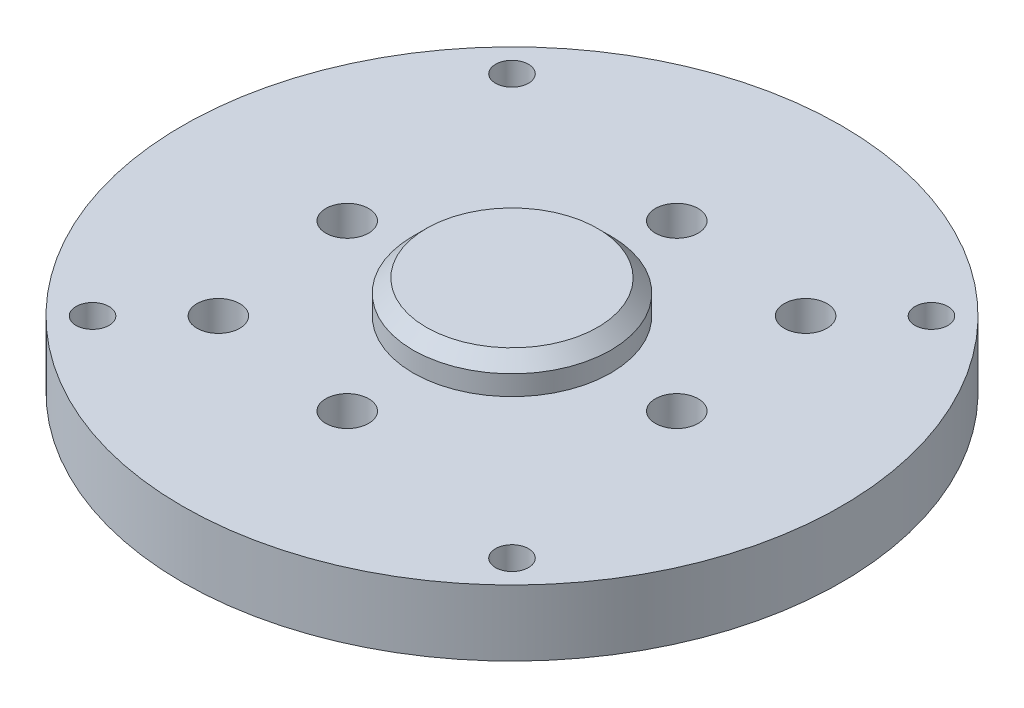
from build123d import *

# Parameters (mm, degrees)
SKETCH1_W               = 100
SKETCH1_H               = 100
BOSS_EXTRUDE1_DEPTH     = 10
SKETCH2_R               = 3.25
CUT_EXTRUDE1_DEPTH      = 10
SKETCH3_OUTSIDE_W       = 130.354
SKETCH3_OUTSIDE_H       = 130.354
SKETCH3_OUTSIDE_R       = 50
CUT_EXTRUDE2_DEPTH      = 10
SKETCH4_R               = 2.5
CUT_EXTRUDE3_DEPTH      = 10
SKETCH5_R               = 3.25
CUT_EXTRUDE4_DEPTH      = 10
SKETCH6_R               = 6.25
CUT_EXTRUDE5_DEPTH      = 5
SKETCH7_R               = 15
BOSS_EXTRUDE2_DEPTH     = 5
CHAMFER1_SIZE           = 2
SKETCH8_R               = 41
SKETCH8_R_2             = 27
CUT_EXTRUDE_THIN1_DEPTH = 4


with BuildPart() as part:
    # Sketch1 → Boss-Extrude1 (new body)
    with BuildSketch(Plane(origin=(0, 0, 0), x_dir=(1, 0, 0), z_dir=(0, 1, 0))):
        Rectangle(SKETCH1_W, SKETCH1_H)
    extrude(amount=BOSS_EXTRUDE1_DEPTH)

    # Sketch2 → Cut-Extrude1 (cut)
    with BuildSketch(Plane(origin=(0, 10, 0), x_dir=(1, 0, 0), z_dir=(0, 1, 0))):
        with Locations(Location((-25, 0, 0), (0, 0, 270))):
            Circle(SKETCH2_R)
        with Locations(Location((0, 25, 0), (0, 0, 270))):
            Circle(SKETCH2_R)
        with Locations(Location((25, 0, 0), (0, 0, 270))):
            Circle(SKETCH2_R)
        with Locations(Location((0, -25, 0), (0, 0, 270))):
            Circle(SKETCH2_R)
    extrude(amount=-CUT_EXTRUDE1_DEPTH, mode=Mode.SUBTRACT)

    # Sketch3 outside → Cut-Extrude2 (cut)
    with BuildSketch(Plane(origin=(0, 10, 0), x_dir=(1, 0, 0), z_dir=(0, 1, 0))):
        Rectangle(SKETCH3_OUTSIDE_W, SKETCH3_OUTSIDE_H)
        with Locations(Location((0, 0, 0), (0, 0, 270))):
            Circle(SKETCH3_OUTSIDE_R, mode=Mode.SUBTRACT)
    extrude(amount=-CUT_EXTRUDE2_DEPTH, mode=Mode.SUBTRACT)

    # Sketch4 → Cut-Extrude3 (cut)
    with BuildSketch(Plane(origin=(0, 10, 0), x_dir=(1, 0, 0), z_dir=(0, 1, 0))):
        with Locations(Location((-31.819805153, 31.819805153, 0), (0, 0, 270))):
            Circle(SKETCH4_R)
        with Locations(Location((31.819805153, 31.819805153, 0), (0, 0, 270))):
            Circle(SKETCH4_R)
        with Locations(Location((31.819805153, -31.819805153, 0), (0, 0, 270))):
            Circle(SKETCH4_R)
        with Locations(Location((-31.819805153, -31.819805153, 0), (0, 0, 270))):
            Circle(SKETCH4_R)
    extrude(amount=-CUT_EXTRUDE3_DEPTH, mode=Mode.SUBTRACT)

    # Sketch5 → Cut-Extrude4 (cut)
    with BuildSketch(Plane.XZ):
        with Locations(Location((-22.273863607, 22.273863607, 0), (0, 0, 270))):
            Circle(SKETCH5_R)
        with Locations(Location((22.273863607, -22.273863607, 0), (0, 0, 270))):
            Circle(SKETCH5_R)
    extrude(amount=-CUT_EXTRUDE4_DEPTH, mode=Mode.SUBTRACT)

    # Sketch6 → Cut-Extrude5 (cut)
    with BuildSketch(Plane.XZ):
        with Locations(Location((25, 0, 0), (0, 0, 270))):
            Circle(SKETCH6_R)
        with Locations(Location((22.273863607, -22.273863607, 0), (0, 0, 270))):
            Circle(SKETCH6_R)
        with Locations(Location((0, -25, 0), (0, 0, 270))):
            Circle(SKETCH6_R)
        with Locations(Location((-25, 0, 0), (0, 0, 270))):
            Circle(SKETCH6_R)
        with Locations(Location((-22.273863607, 22.273863607, 0), (0, 0, 270))):
            Circle(SKETCH6_R)
        with Locations(Location((0, 25, 0), (0, 0, 270))):
            Circle(SKETCH6_R)
    extrude(amount=-CUT_EXTRUDE5_DEPTH, mode=Mode.SUBTRACT)

    # Sketch7 → Boss-Extrude2 (add)
    with BuildSketch(Plane(origin=(0, 10, 0), x_dir=(1, 0, 0), z_dir=(0, 1, 0))):
        with Locations(Location((0, 0, 0), (0, 0, 90))):
            Circle(SKETCH7_R)
    extrude(amount=BOSS_EXTRUDE2_DEPTH)

    # Chamfer1
    chamfer1_edges = [part.edges().sort_by_distance(p)[0] for p in [
        (0, 15, 15),
    ]]
    chamfer(chamfer1_edges, length=CHAMFER1_SIZE)

    # Sketch8 → Cut-Extrude-Thin1 (cut)
    with BuildSketch(Plane.XZ):
        Circle(SKETCH8_R)
        Circle(SKETCH8_R_2, mode=Mode.SUBTRACT)
    extrude(amount=-CUT_EXTRUDE_THIN1_DEPTH, mode=Mode.SUBTRACT)


solid = part.part
